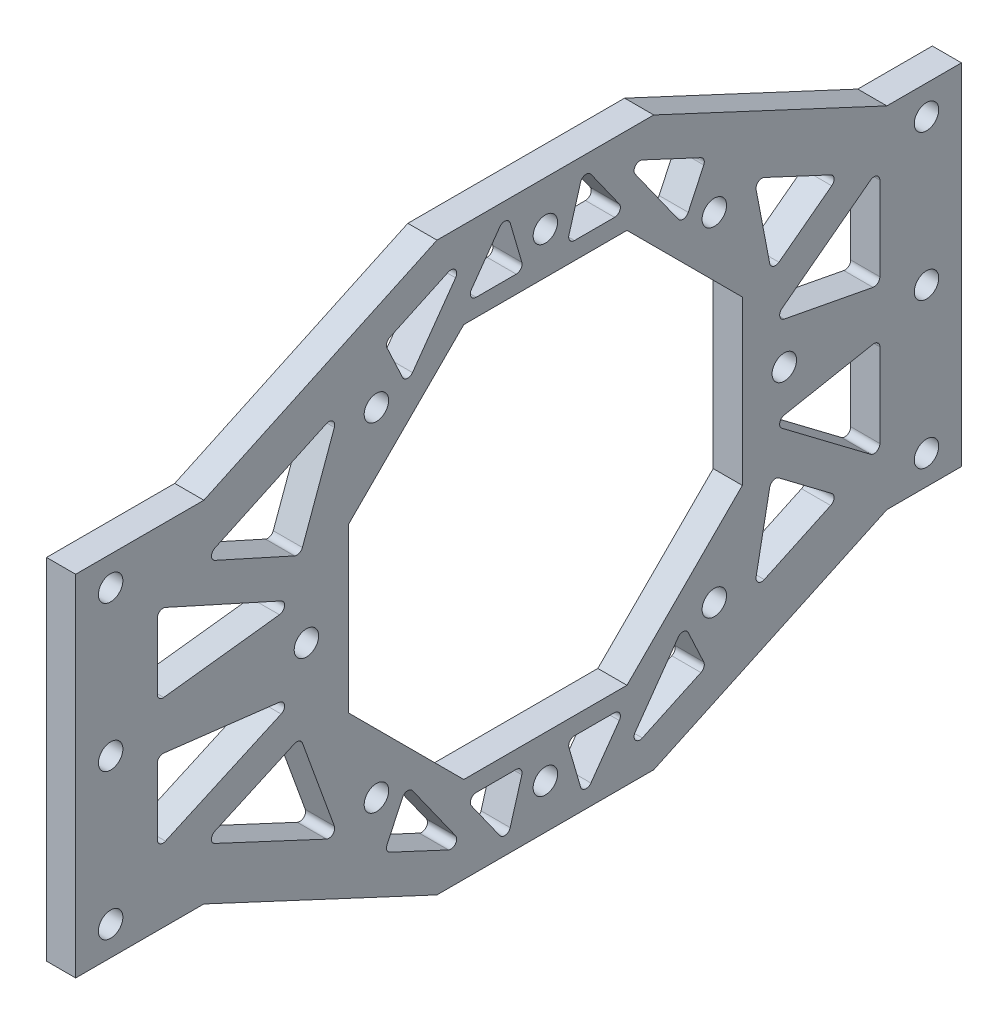
from build123d import *

# Parameters (mm, degrees)
SKETCH_1_W          = 157.2
SKETCH_1_H          = 60
SKETCH_1_R          = 2.1
EXTRUDE_1_DEPTH     = 5
SKETCH_2_R          = 2.1
EXTRUDE_2_DEPTH     = 5
SKETCH_2_3_R        = 2.1
CUT_EXTRUDE_1_DEPTH = 5
CUT_EXTRUDE_2_DEPTH = 5
SKETCH_4_W          = 7.2
SKETCH_4_H          = 60
CUT_EXTRUDE_3_DEPTH = 93.574331814
SKETCH_5_W          = 2
SKETCH_5_H          = 60
EXTRUDE_3_DEPTH     = 5


with BuildPart() as part:
    # 草图1 → 凸台-拉伸1 (new body)
    with BuildSketch(Plane(origin=(0, 0, 0), x_dir=(0, 0, -1), z_dir=(1, 0, 0))):
        Rectangle(SKETCH_1_W, SKETCH_1_H)
        with Locations((-74.6, 0)):
            Circle(SKETCH_1_R, mode=Mode.SUBTRACT)
        with Locations((-74.6, 25)):
            Circle(SKETCH_1_R, mode=Mode.SUBTRACT)
        with Locations((-74.6, -25)):
            Circle(SKETCH_1_R, mode=Mode.SUBTRACT)
        with Locations((65.4, -25)):
            Circle(SKETCH_1_R, mode=Mode.SUBTRACT)
        with Locations((65.4, 25)):
            Circle(SKETCH_1_R, mode=Mode.SUBTRACT)
        with Locations((65.4, 0)):
            Circle(SKETCH_1_R, mode=Mode.SUBTRACT)
    extrude(amount=EXTRUDE_1_DEPTH)

    # 草图2 → 凸台-拉伸2 (add)
    # profile 1 of 3: a face of its own
    with BuildSketch(Plane(origin=(5, 0, 0), x_dir=(0, 0, -1), z_dir=(1, 0, 0))):
        with BuildLine():
            Line((-18.6, 48.652306326), (-58.6, 30))
            Line((-58.6, 30), (-30.833301404, 30))
            ThreePointArc((-30.833301404, 30), (-28.991378029, 31.091378029), (-27.149454654, 30))
            Line((-27.149454654, 30), (27.149454654, 30))
            ThreePointArc((27.149454654, 30), (28.991378029, 31.091378029), (30.833301404, 30))
            Line((30.833301404, 30), (58.6, 30))
            Line((58.6, 30), (18.6, 48.652306326))
            Line((18.6, 48.652306326), (-18.6, 48.652306326))
        make_face()
        with Locations((0, 41)):
            Circle(SKETCH_2_R, mode=Mode.SUBTRACT)
    # profile 2 of 3: a face of its own
    with BuildSketch(Plane(origin=(5, 0, 0), x_dir=(0, 0, -1), z_dir=(1, 0, 0))):
        with BuildLine():
            Line((-30.833301404, -30), (-58.6, -30))
            Line((-58.6, -30), (-18.6, -48.652306326))
            Line((-18.6, -48.652306326), (0, -48.652306326))
            Line((0, -48.652306326), (0, -43.1))
            ThreePointArc((0, -43.1), (-2.1, -41), (0, -38.9))
            Line((0, -38.9), (0, -30))
            Line((0, -30), (-27.149454654, -30))
            ThreePointArc((-27.149454654, -30), (-28.991378029, -31.091378029), (-30.833301404, -30))
        make_face()
    # profile 3 of 3: a face of its own
    with BuildSketch(Plane(origin=(5, 0, 0), x_dir=(0, 0, -1), z_dir=(1, 0, 0))):
        with BuildLine():
            Line((0, -43.1), (0, -48.652306326))
            Line((0, -48.652306326), (18.6, -48.652306326))
            Line((18.6, -48.652306326), (58.6, -30))
            Line((58.6, -30), (30.833301404, -30))
            ThreePointArc((30.833301404, -30), (28.991378029, -31.091378029), (27.149454654, -30))
            Line((27.149454654, -30), (0, -30))
            Line((0, -30), (0, -38.9))
            ThreePointArc((0, -38.9), (1.48492424, -39.51507576), (2.1, -41))
            ThreePointArc((2.1, -41), (1.48492424, -42.48492424), (0, -43.1))
        make_face()
    extrude(amount=-EXTRUDE_2_DEPTH)

    # 草图2<3> → 切除-拉伸1 (cut)
    with BuildSketch(Plane(origin=(5, 0, 0), x_dir=(0, 0, -1), z_dir=(1, 0, 0))):
        with BuildLine():
            Line((-27.149454654, 30), (-30.833301404, 30))
            ThreePointArc((-30.833301404, 30), (-29.511935861, 26.956919982), (-26.891378029, 28.991378029))
            ThreePointArc((-26.891378029, 28.991378029), (-26.956919982, 29.511935861), (-27.149454654, 30))
        make_face()
        with BuildLine():
            ThreePointArc((-27.149454654, 30), (-28.991378029, 31.091378029), (-30.833301404, 30))
            Line((-30.833301404, 30), (-27.149454654, 30))
        make_face()
        with BuildLine():
            Line((-27.149454654, -30), (-30.833301404, -30))
            ThreePointArc((-30.833301404, -30), (-28.991378029, -31.091378029), (-27.149454654, -30))
        make_face()
        with BuildLine():
            ThreePointArc((-26.891378029, -28.991378029), (-29.511935861, -26.956919982), (-30.833301404, -30))
            Line((-30.833301404, -30), (-27.149454654, -30))
            ThreePointArc((-27.149454654, -30), (-26.956919982, -29.511935861), (-26.891378029, -28.991378029))
        make_face()
        with BuildLine():
            Line((30.833301404, -30), (27.149454654, -30))
            ThreePointArc((27.149454654, -30), (28.991378029, -31.091378029), (30.833301404, -30))
        make_face()
        with BuildLine():
            ThreePointArc((31.091378029, -28.991378029), (28.470820197, -26.956919982), (27.149454654, -30))
            Line((27.149454654, -30), (30.833301404, -30))
            ThreePointArc((30.833301404, -30), (31.025836075, -29.511935861), (31.091378029, -28.991378029))
        make_face()
        with Locations((41, 0)):
            Circle(SKETCH_2_3_R)
        with BuildLine():
            Line((30.833301404, 30), (27.149454654, 30))
            ThreePointArc((27.149454654, 30), (28.470820197, 26.956919982), (31.091378029, 28.991378029))
            ThreePointArc((31.091378029, 28.991378029), (31.025836075, 29.511935861), (30.833301404, 30))
        make_face()
        with BuildLine():
            ThreePointArc((30.833301404, 30), (28.991378029, 31.091378029), (27.149454654, 30))
            Line((27.149454654, 30), (30.833301404, 30))
        make_face()
        with Locations((-41, 0)):
            Circle(SKETCH_2_3_R)
    extrude(amount=-CUT_EXTRUDE_1_DEPTH, mode=Mode.SUBTRACT)

    # 草图3 → 切除-拉伸2 (cut)
    with BuildSketch(Plane.ZY):
        Polygon((-14, 33.798989873), (-33.798989873, 14), (-33.798989873, -14), (-14, -33.798989873), (14, -33.798989873), (33.798989873, -14), (33.798989873, 14), (14, 33.798989873), align=None)
    extrude(amount=-CUT_EXTRUDE_2_DEPTH, mode=Mode.SUBTRACT)

    # 草图4 → 切除-拉伸3 (cut, through all)
    with BuildSketch(Plane.ZY):
        with Locations((-75, 0)):
            Rectangle(SKETCH_4_W, SKETCH_4_H)
        with BuildLine():
            Line((-48.957842123, 24.565810788), (-37.564284366, 29.878714024))
            ThreePointArc((-37.564284366, 29.878714024), (-36.526778802, 29.76102123), (-36.159666041, 28.78352565))
            Line((-36.159666041, 28.78352565), (-38.495867868, 16.637490042))
            ThreePointArc((-38.495867868, 16.637490042), (-39.118843635, 15.893042416), (-40.080128381, 16.028070968))
            Line((-40.080128381, 16.028070968), (-49.137484312, 22.86120334))
            ThreePointArc((-49.137484312, 22.86120334), (-49.529716562, 23.764308859), (-48.957842123, 24.565810788))
        make_face()
        with BuildLine():
            Line((-55.79773955, 20.369918705), (-40.59944805, 8.903886185))
            ThreePointArc((-40.59944805, 8.903886185), (-40.227812062, 7.878593732), (-41.014468039, 7.123272414))
            Line((-41.014468039, 7.123272414), (-56.212759539, 4.2263018))
            ThreePointArc((-56.212759539, 4.2263018), (-57.037479231, 4.438148369), (-57.4, 5.20861591))
            Line((-57.4, 5.20861591), (-57.4, 19.571619043))
            ThreePointArc((-57.4, 19.571619043), (-56.845948175, 20.466677826), (-55.79773955, 20.369918705))
        make_face()
        with BuildLine():
            Line((-11.872494928, 36.798989873), (-5, 36.798989873))
            ThreePointArc((-5, 36.798989873), (-4.199954981, 37.199049904), (-4.040042031, 38.079133939))
            Line((-4.040042031, 38.079133939), (-6.040042031, 44.932450392))
            ThreePointArc((-6.040042031, 44.932450392), (-6.833723099, 45.638385427), (-7.815010057, 45.231753138))
            Line((-7.815010057, 45.231753138), (-12.687504985, 38.378436685))
            ThreePointArc((-12.687504985, 38.378436685), (-12.76115876, 37.340430614), (-11.872494928, 36.798989873))
        make_face()
        with BuildLine():
            Line((-16.642957086, 42.94462291), (-26.692429678, 38.25847688))
            ThreePointArc((-26.692429678, 38.25847688), (-27.209504037, 37.694189237), (-27.176119204, 36.929550832))
            Line((-27.176119204, 36.929550832), (-24.515277255, 31.223356859))
            ThreePointArc((-24.515277255, 31.223356859), (-23.69970324, 30.650099937), (-22.793959412, 31.066528309))
            Line((-22.793959412, 31.066528309), (-15.405328768, 41.458868312))
            ThreePointArc((-15.405328768, 41.458868312), (-15.451990263, 42.678346754), (-16.642957086, 42.94462291))
        make_face()
        with BuildLine():
            Line((-12.687504985, -38.378436685), (-7.815010057, -45.231753138))
            ThreePointArc((-7.815010057, -45.231753138), (-6.833723099, -45.638385427), (-6.040042031, -44.932450392))
            Line((-6.040042031, -44.932450392), (-4.040042031, -38.079133939))
            ThreePointArc((-4.040042031, -38.079133939), (-4.199954981, -37.199049904), (-5, -36.798989873))
            Line((-5, -36.798989873), (-11.872494928, -36.798989873))
            ThreePointArc((-11.872494928, -36.798989873), (-12.76115876, -37.340430614), (-12.687504985, -38.378436685))
        make_face()
        with BuildLine():
            Line((-27.176119204, -36.929550832), (-24.515277255, -31.223356859))
            ThreePointArc((-24.515277255, -31.223356859), (-23.69970324, -30.650099937), (-22.793959412, -31.066528309))
            Line((-22.793959412, -31.066528309), (-15.405328768, -41.458868312))
            ThreePointArc((-15.405328768, -41.458868312), (-15.451990263, -42.678346754), (-16.642957086, -42.94462291))
            Line((-16.642957086, -42.94462291), (-26.692429678, -38.25847688))
            ThreePointArc((-26.692429678, -38.25847688), (-27.209504037, -37.694189237), (-27.176119204, -36.929550832))
        make_face()
        with BuildLine():
            Line((-36.159666041, -28.78352565), (-38.495867868, -16.637490042))
            ThreePointArc((-38.495867868, -16.637490042), (-39.118843635, -15.893042416), (-40.080128381, -16.028070968))
            Line((-40.080128381, -16.028070968), (-49.137484312, -22.86120334))
            ThreePointArc((-49.137484312, -22.86120334), (-49.529716562, -23.764308859), (-48.957842123, -24.565810788))
            Line((-48.957842123, -24.565810788), (-37.564284366, -29.878714024))
            ThreePointArc((-37.564284366, -29.878714024), (-36.526778802, -29.76102123), (-36.159666041, -28.78352565))
        make_face()
        with BuildLine():
            Line((-41.014468039, -7.123272414), (-56.212759539, -4.2263018))
            ThreePointArc((-56.212759539, -4.2263018), (-57.037479231, -4.438148369), (-57.4, -5.20861591))
            Line((-57.4, -5.20861591), (-57.4, -19.571619043))
            ThreePointArc((-57.4, -19.571619043), (-56.845948175, -20.466677826), (-55.79773955, -20.369918705))
            Line((-55.79773955, -20.369918705), (-40.59944805, -8.903886185))
            ThreePointArc((-40.59944805, -8.903886185), (-40.227812062, -7.878593732), (-41.014468039, -7.123272414))
        make_face()
        with BuildLine():
            Line((11.872494928, -36.798989873), (5, -36.798989873))
            ThreePointArc((5, -36.798989873), (4.199954981, -37.199049904), (4.040042031, -38.079133939))
            Line((4.040042031, -38.079133939), (6.040042031, -44.932450392))
            ThreePointArc((6.040042031, -44.932450392), (6.833723099, -45.638385427), (7.815010057, -45.231753138))
            Line((7.815010057, -45.231753138), (12.687504985, -38.378436685))
            ThreePointArc((12.687504985, -38.378436685), (12.76115876, -37.340430614), (11.872494928, -36.798989873))
        make_face()
        with BuildLine():
            Line((16.642957086, -42.94462291), (26.692429678, -38.25847688))
            ThreePointArc((26.692429678, -38.25847688), (27.209504037, -37.694189237), (27.176119204, -36.929550832))
            Line((27.176119204, -36.929550832), (24.515277255, -31.223356859))
            ThreePointArc((24.515277255, -31.223356859), (23.69970324, -30.650099937), (22.793959412, -31.066528309))
            Line((22.793959412, -31.066528309), (15.405328768, -41.458868312))
            ThreePointArc((15.405328768, -41.458868312), (15.451990263, -42.678346754), (16.642957086, -42.94462291))
        make_face()
        with BuildLine():
            Line((12.687504985, 38.378436685), (7.815010057, 45.231753138))
            ThreePointArc((7.815010057, 45.231753138), (6.833723099, 45.638385427), (6.040042031, 44.932450392))
            Line((6.040042031, 44.932450392), (4.040042031, 38.079133939))
            ThreePointArc((4.040042031, 38.079133939), (4.199954981, 37.199049904), (5, 36.798989873))
            Line((5, 36.798989873), (11.872494928, 36.798989873))
            ThreePointArc((11.872494928, 36.798989873), (12.76115876, 37.340430614), (12.687504985, 38.378436685))
        make_face()
        with BuildLine():
            Line((27.176119204, 36.929550832), (24.515277255, 31.223356859))
            ThreePointArc((24.515277255, 31.223356859), (23.69970324, 30.650099937), (22.793959412, 31.066528309))
            Line((22.793959412, 31.066528309), (15.405328768, 41.458868312))
            ThreePointArc((15.405328768, 41.458868312), (15.451990263, 42.678346754), (16.642957086, 42.94462291))
            Line((16.642957086, 42.94462291), (26.692429678, 38.25847688))
            ThreePointArc((26.692429678, 38.25847688), (27.209504037, 37.694189237), (27.176119204, 36.929550832))
        make_face()
        with BuildLine():
            Line((37.570934319, 30.873032517), (56.72867915, 21.93962939))
            ThreePointArc((56.72867915, 21.93962939), (57.306041973, 21.027171005), (56.717498716, 20.121883775))
            Line((56.717498716, 20.121883775), (43.044905403, 13.949853253))
            ThreePointArc((43.044905403, 13.949853253), (42.244764771, 13.93992789), (41.693519696, 14.519973071))
            Line((41.693519696, 14.519973071), (36.208368178, 29.625406721))
            ThreePointArc((36.208368178, 29.625406721), (36.473001305, 30.70425438), (37.570934319, 30.873032517))
        make_face()
        with BuildLine():
            Line((45.338442554, 8.402187901), (65.188562172, 17.362854057))
            ThreePointArc((65.188562172, 17.362854057), (66.142476807, 17.291487009), (66.6, 16.45141623))
            Line((66.6, 16.45141623), (66.6, 5.126190544))
            ThreePointArc((66.6, 5.126190544), (66.263971229, 4.378432424), (65.481715587, 4.133210787))
            Line((65.481715587, 4.133210787), (45.631595969, 6.497770317))
            ThreePointArc((45.631595969, 6.497770317), (44.761521643, 7.338608683), (45.338442554, 8.402187901))
        make_face()
        with BuildLine():
            Line((66.6, -16.45141623), (66.6, -5.126190544))
            ThreePointArc((66.6, -5.126190544), (66.263971229, -4.378432424), (65.481715587, -4.133210787))
            Line((65.481715587, -4.133210787), (45.631595969, -6.497770317))
            ThreePointArc((45.631595969, -6.497770317), (44.761521643, -7.338608683), (45.338442554, -8.402187901))
            Line((45.338442554, -8.402187901), (65.188562172, -17.362854057))
            ThreePointArc((65.188562172, -17.362854057), (66.142476807, -17.291487009), (66.6, -16.45141623))
        make_face()
        with BuildLine():
            Line((56.717498716, -20.121883775), (43.044905403, -13.949853253))
            ThreePointArc((43.044905403, -13.949853253), (42.244764771, -13.93992789), (41.693519696, -14.519973071))
            Line((41.693519696, -14.519973071), (36.208368178, -29.625406721))
            ThreePointArc((36.208368178, -29.625406721), (36.473001305, -30.70425438), (37.570934319, -30.873032517))
            Line((37.570934319, -30.873032517), (56.72867915, -21.93962939))
            ThreePointArc((56.72867915, -21.93962939), (57.306041973, -21.027171005), (56.717498716, -20.121883775))
        make_face()
    extrude(amount=-CUT_EXTRUDE_3_DEPTH, mode=Mode.SUBTRACT)

    # 草图5 → 凸台-拉伸3 (add)
    with BuildSketch(Plane.ZY):
        with Locations((79.6, 0)):
            Rectangle(SKETCH_5_W, SKETCH_5_H)
    extrude(amount=-EXTRUDE_3_DEPTH)


solid = part.part
